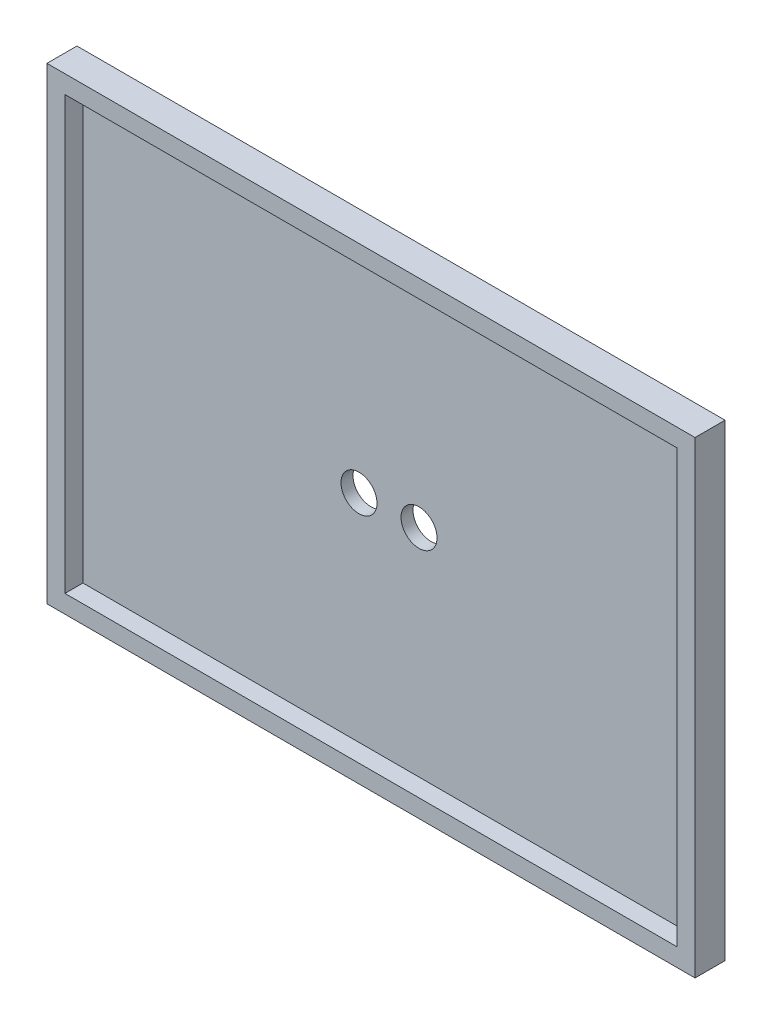
from build123d import *

# Parameters (mm, degrees)
SKIZZE1_W                       = 108
SKIZZE1_H                       = 78
AUFSATZ_LINEAR_AUSTRAGEN1_DEPTH = 5
SKIZZE2_W                       = 102
SKIZZE2_H                       = 72
SCHNITT_LINEAR_AUSTRAGEN1_DEPTH = 3
SKIZZE3_R                       = 3
SCHNITT_LINEAR_AUSTRAGEN2_DEPTH = 3
SKIZZE4_R                       = 10
SKIZZE4_R_2                     = 3
AUFSATZ_LINEAR_AUSTRAGEN2_DEPTH = 25


with BuildPart() as part:
    # Skizze1 → Aufsatz-Linear austragen1 (new body)
    with BuildSketch(Plane.XY):
        with Locations((-34.920453515, 9.024489796)):
            Rectangle(SKIZZE1_W, SKIZZE1_H)
    extrude(amount=AUFSATZ_LINEAR_AUSTRAGEN1_DEPTH)

    # Skizze2 → Schnitt-Linear austragen1 (cut)
    with BuildSketch(Plane.XY.offset(5)):
        with Locations((-34.920453515, 9.024489796)):
            Rectangle(SKIZZE2_W, SKIZZE2_H)
    extrude(amount=-SCHNITT_LINEAR_AUSTRAGEN1_DEPTH, mode=Mode.SUBTRACT)

    # Skizze3 → Schnitt-Linear austragen2 (cut)
    with BuildSketch(Plane.XY.offset(2)):
        with Locations((-39.920453515, 9.024489796)):
            Circle(SKIZZE3_R)
        with Locations((-29.920453515, 9.024489796)):
            Circle(SKIZZE3_R)
    extrude(amount=-SCHNITT_LINEAR_AUSTRAGEN2_DEPTH, mode=Mode.SUBTRACT)

    # Skizze4 → Aufsatz-Linear austragen2 (add, along a direction that is not the sketch's normal)
    with BuildSketch(Plane(origin=(0, 0, 0), x_dir=(-1, 0, 0), z_dir=(0, 0, -1))):
        with Locations((34.920453515, 28.024489796)):
            Circle(SKIZZE4_R)
        with Locations((34.920453515, 28.024489796)):
            Circle(SKIZZE4_R_2, mode=Mode.SUBTRACT)
    extrude(amount=AUFSATZ_LINEAR_AUSTRAGEN2_DEPTH, dir=(0, -0.7071067811865538, -0.7071067811865414))


solid = part.part
